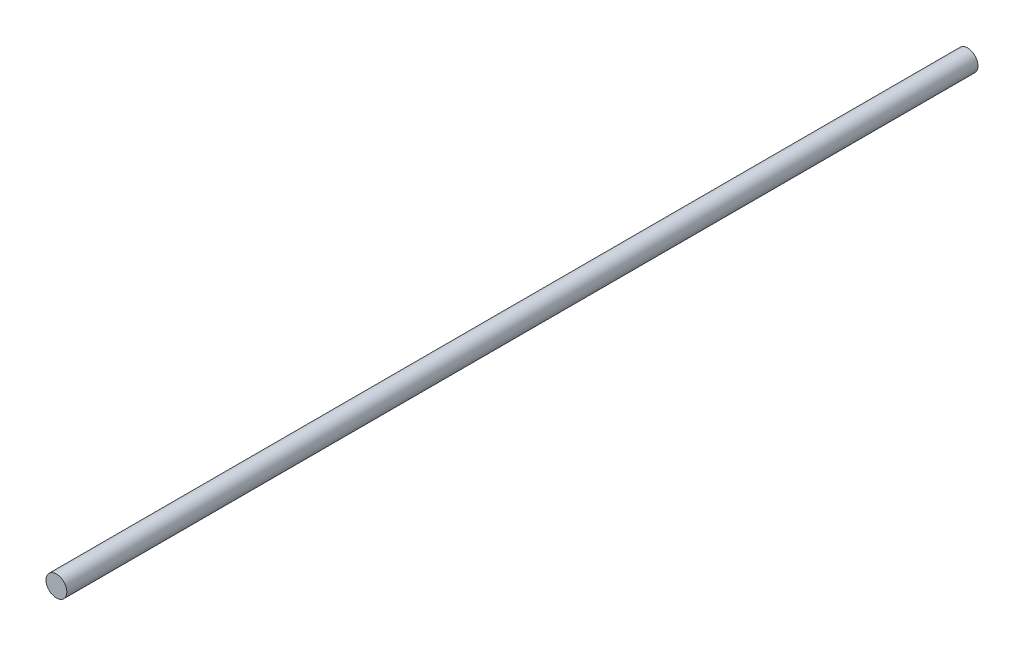
from build123d import *

# Parameters (mm, degrees)
SKETCH1_R           = 4
BOSS_EXTRUDE1_DEPTH = 175


with BuildPart() as part:
    # Sketch1 → Boss-Extrude1 (new, symmetric)
    with BuildSketch(Plane.XY):
        Circle(SKETCH1_R)
    extrude(amount=BOSS_EXTRUDE1_DEPTH, both=True)


solid = part.part
